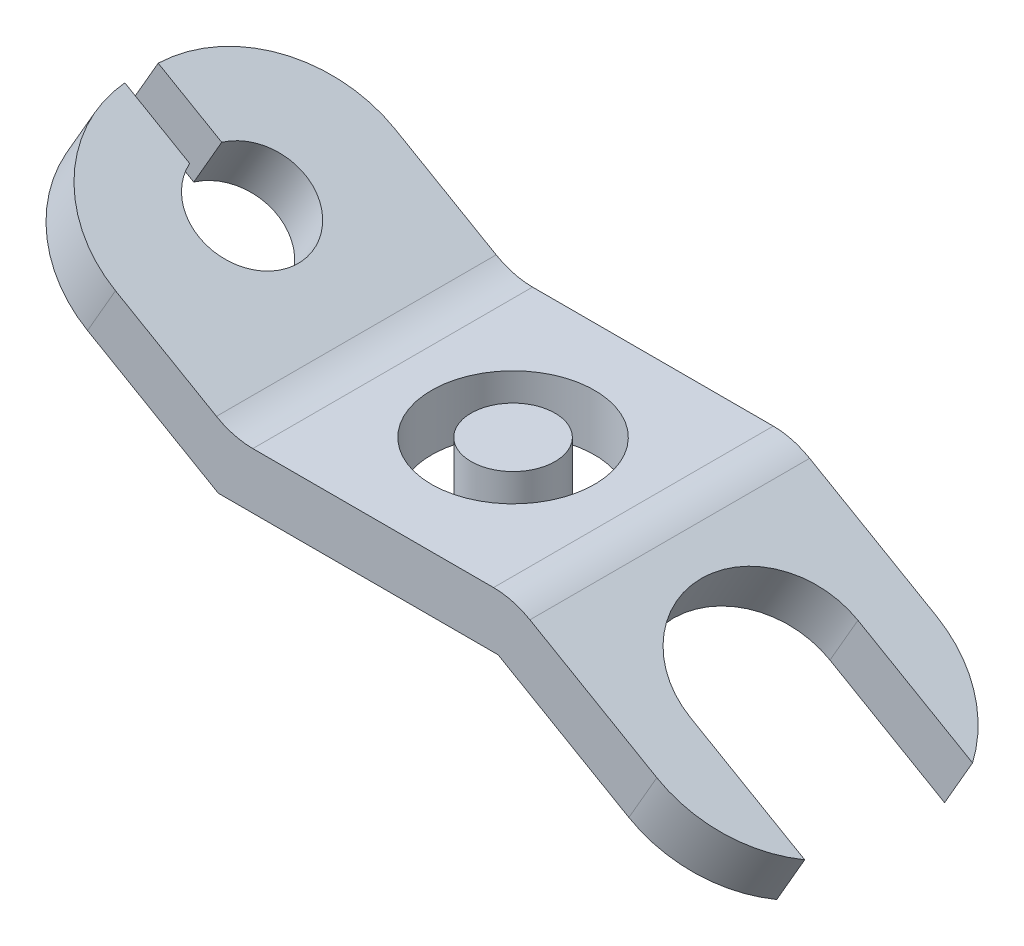
from build123d import *

# Parameters (mm, degrees)
EXTRUDE_THIN1_DEPTH = 50
FILLET1_R           = 23
CUT_EXTRUDE1_START  = -10
SKETCH2_R           = 9.542038154
CUT_EXTRUDE1_DEPTH  = 10
FILLET2_R           = 23
CUT_EXTRUDE2_DEPTH  = 10
SKETCH5_R           = 14.57250647
SKETCH5_R_2         = 7.5
CUT_EXTRUDE3_DEPTH  = 10
FILLET3_R           = 13


with BuildPart() as part:
    # Sketch1 → Extrude-Thin1 (new body)
    with BuildSketch(Plane.XY):
        Polygon((-43.301270189, 25), (0, 0), (50, 0), (93.301270189, -25), (98.301270189, -16.339745962), (52.679491924, 10), (2.679491924, 10), (-38.301270189, 33.660254038), align=None)
    extrude(amount=EXTRUDE_THIN1_DEPTH)

    # Fillet1
    fillet1_edges = [part.edges().sort_by_distance(p)[0] for p in [
        (-40.801270189, 29.330127019, 50),
        (-40.801270189, 29.330127019, 0),
    ]]
    fillet(fillet1_edges, radius=FILLET1_R)

    # Sketch2 → Cut-Extrude1 (cut)
    with BuildSketch(Plane(origin=(5, 8.660254038, 0), x_dir=(0.8660254037844417, -0.4999999999999947, 0), z_dir=(0.4999999999999947, 0.8660254037844417, 0)).offset(CUT_EXTRUDE1_START)):
        with Locations((-27.679491924, -25)):
            Circle(SKETCH2_R)
        with BuildLine():
            Line((-49.953885583, -28.455725473), (-36.57378524, -28.455725473))
            ThreePointArc((-36.57378524, -28.455725473), (-37.209442685, -25.480136062), (-36.876076033, -22.455725473))
            Line((-36.876076033, -22.455725473), (-49.993559212, -22.455725473))
            ThreePointArc((-49.993559212, -22.455725473), (-49.998389747, -22.727843683), (-50, -23))
            Line((-50, -23), (-50, -27))
            ThreePointArc((-50, -27), (-49.988468505, -27.728227848), (-49.953885583, -28.455725473))
        make_face()
    extrude(amount=CUT_EXTRUDE1_DEPTH, mode=Mode.SUBTRACT)

    # Fillet2
    fillet2_edges = [part.edges().sort_by_distance(p)[0] for p in [
        (95.801270189, -20.669872981, 50),
        (95.801270189, -20.669872981, 0),
    ]]
    fillet(fillet2_edges, radius=FILLET2_R)

    # Sketch4 → Cut-Extrude2 (cut)
    with BuildSketch(Plane(origin=(17.5, 30.310889132, 0), x_dir=(0.8660254037844382, -0.500000000000001, 0), z_dir=(0.500000000000001, 0.8660254037844382, 0))):
        with BuildLine():
            Line((65.621778265, -10), (93.301270189, -10))
            ThreePointArc((93.301270189, -10), (108.301270189, -25), (93.301270189, -40))
            Line((93.301270189, -40), (65.621778265, -40))
            ThreePointArc((65.621778265, -40), (50.621778265, -25), (65.621778265, -10))
        make_face()
    extrude(amount=-CUT_EXTRUDE2_DEPTH, mode=Mode.SUBTRACT)

    # Sketch5 → Cut-Extrude3 (cut)
    with BuildSketch(Plane(origin=(0, 10, 0), x_dir=(1, 0, 0), z_dir=(0, 1, 0))):
        with Locations(Location((27.679491924, -25, 0), (0, 0, 270))):
            Circle(SKETCH5_R)
        with Locations(Location((27.679491924, -25, 0), (0, 0, 270))):
            Circle(SKETCH5_R_2, mode=Mode.SUBTRACT)
    extrude(amount=-CUT_EXTRUDE3_DEPTH, mode=Mode.SUBTRACT)


with BuildPart() as cut_extrude3_piece_1:
    # of the separate pieces the step leaves, piece 1, a body of its own (cut_extrude3_pieces)
    add(part.part.solids().sort_by_distance((73.382685902, -13.5, 0))[0])

    # Fillet3
    fillet3_edges = [cut_extrude3_piece_1.edges().sort_by_distance(p)[0] for p in [
        (2.679491924, 10, 25),
        (52.679491924, 10, 25),
    ]]
    fillet(fillet3_edges, radius=FILLET3_R)


with BuildPart() as cut_extrude3_piece_2:
    # of the separate pieces the step leaves, piece 2, a body of its own (cut_extrude3_pieces)
    add(part.part.solids().sort_by_distance((27.679491924, 0, 32.5))[0])


solid = Compound([cut_extrude3_piece_1.part, cut_extrude3_piece_2.part])
